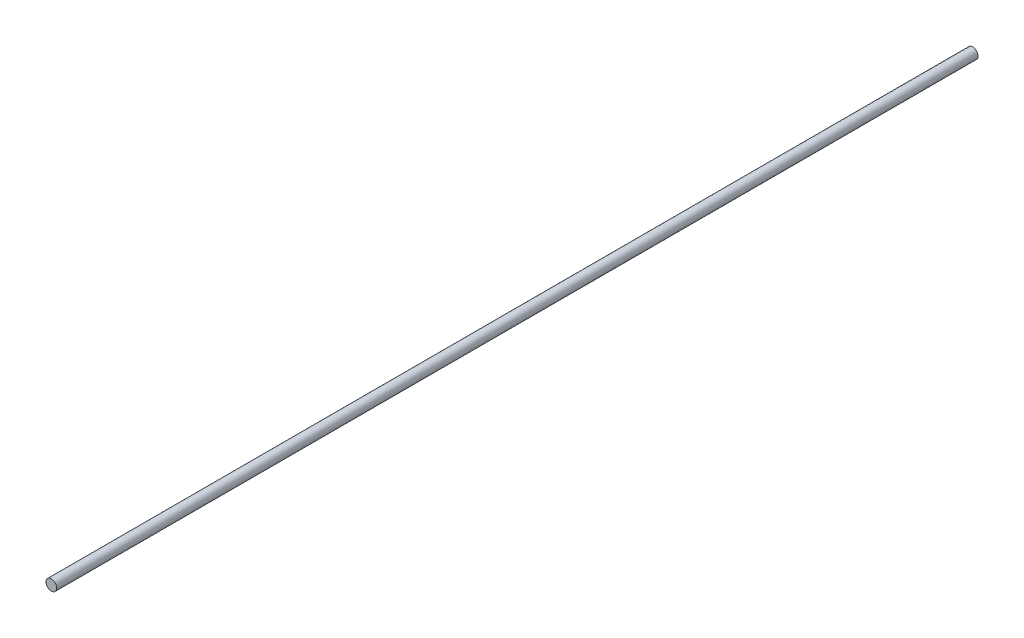
from build123d import *

# Parameters (mm, degrees)
SKETCH1_R           = 3
BOSS_EXTRUDE1_DEPTH = 520


with BuildPart() as part:
    # Sketch1 → Boss-Extrude1 (new body)
    with BuildSketch(Plane.XY):
        Circle(SKETCH1_R)
    extrude(amount=BOSS_EXTRUDE1_DEPTH)


solid = part.part
